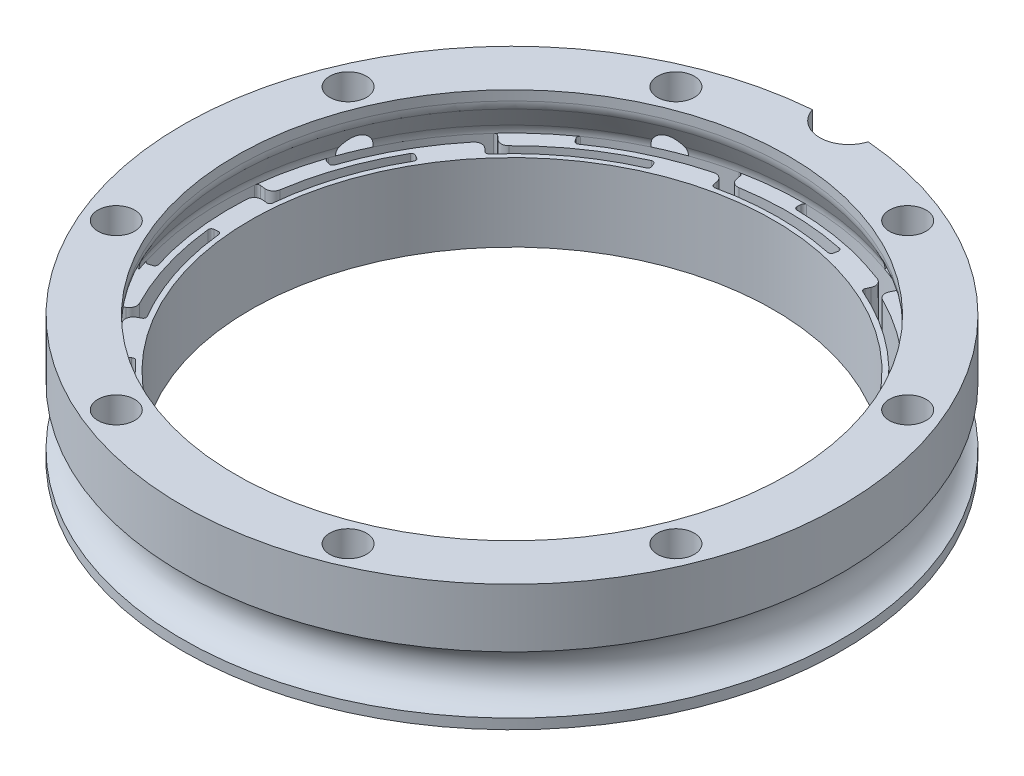
from build123d import *

# Parameters (mm, degrees)
SKETCH1_R                                 = 34
SKETCH1_R_2                               = 27
BOSS_EXTRUDE1_DEPTH                       = 4
CUT_EXTRUDE2_DEPTH                        = 49.744230428
FILLET1_R                                 = 0.3
FILLET2_R                                 = 0.8
CIRPATTERN1_COUNT                         = 10
FILLET1_OF_CIRPATTERN1_R                  = 0.3
FILLET2_OF_CIRPATTERN1_R                  = 0.8
SKETCH6_R                                 = 3.05
SKETCH7_R                                 = 3
CUT_EXTRUDE3_DEPTH                        = 5
CUT_EXTRUDE3_DIRECTION_2_REACH            = 50.744
CUT_EXTRUDE3_DIRECTION_2_END_MAJOR_RADIUS = 34.75
CUT_EXTRUDE3_DIRECTION_2_END_MINOR_RADIUS = 3.05
CUT_EXTRUDE4_REACH                        = 51.81
SKETCH11_R                                = 1.9


with BuildPart() as part:
    # Sketch1 → Boss-Extrude1 (new, symmetric)
    with BuildSketch(Plane(origin=(0, 0, 0), x_dir=(1, 0, 0), z_dir=(0, 1, 0))):
        with Locations(Location((0, 0, 0), (0, 0, 270))):
            Circle(SKETCH1_R)
        with Locations(Location((0, 0, 0), (0, 0, 270))):
            Circle(SKETCH1_R_2, mode=Mode.SUBTRACT)
    extrude(amount=BOSS_EXTRUDE1_DEPTH, both=True)

    # Sketch3 → Cut-Extrude2 (cut, through all)
    with BuildSketch(Plane(origin=(0, 4, 0), x_dir=(1, 0, 0), z_dir=(0, 1, 0))):
        with BuildLine():
            Line((12.720809678, 27.27986439), (12.04462046, 25.829771931))
            ThreePointArc((12.04462046, 25.829771931), (17.055348094, 22.833420711), (21.350359788, 18.878880712))
            Line((21.350359788, 18.878880712), (20.601224357, 18.216463844))
            ThreePointArc((20.601224357, 18.216463844), (16.053540973, 22.327870974), (10.708007901, 25.329598631))
            Line((10.708007901, 25.329598631), (11.384620002, 26.780597966))
            ThreePointArc((11.384620002, 26.780597966), (5.809242601, 28.514254337), (0, 29.1))
            Line((0, 29.1), (0, 30.1))
            ThreePointArc((0, 30.1), (6.51483238, 29.386509814), (12.720809678, 27.27986439))
        make_face()
    cut_extrude2 = extrude(amount=-CUT_EXTRUDE2_DEPTH, mode=Mode.SUBTRACT)

    # Fillet1
    fillet1_edges = [part.edges().sort_by_distance(p)[0] for p in [
        (0, 0, -30.1),
        (12.720809678, 0, -27.27986439),
        (21.350359788, 0, -18.878880712),
        (20.601224357, 0, -18.216463844),
        (10.708007901, 0, -25.329598631),
        (0, 0, -29.1),
    ]]
    fillet(fillet1_edges, radius=FILLET1_R)

    # Fillet2
    fillet2_edges = [part.edges().sort_by_distance(p)[0] for p in [
        (12.04462046, 0, -25.829771931),
        (11.384620002, 0, -26.780597966),
    ]]
    fillet(fillet2_edges, radius=FILLET2_R)

    # CirPattern1: Cut-Extrude2 ×10 about axis
    cirpattern1_axis = Axis((0, 0, 0), (0, 1, 0))
    for i in range(1, CIRPATTERN1_COUNT):
        add(cut_extrude2.rotate(cirpattern1_axis, i * 360 / CIRPATTERN1_COUNT), mode=Mode.SUBTRACT)

    # Fillet1 of CirPattern1
    fillet1_of_cirpattern1_edges = [part.edges().sort_by_distance(p)[0] for p in [
        (-17.692336094, 0, -24.351411531),
        (-5.743350761, 0, -29.546978222),
        (6.176076243, 0, -27.822761945),
        (5.959371813, 0, -26.846524684),
        (-6.225404154, 0, -26.786084878),
        (-17.104550842, 0, -23.542394536),
        (-28.62680114, 0, -9.301411531),
        (-22.013746419, 0, -20.528150638),
        (-11.357258511, 0, -26.139293776),
        (-10.958758212, 0, -25.222125574),
        (-20.780923416, 0, -18.011197128),
        (-27.675744624, 0, -8.992394536),
        (-28.62680114, 0, 9.301411531),
        (-29.875639164, 0, -3.668267236),
        (-24.552506532, 0, -14.471503827),
        (-23.691015074, 0, -13.963731763),
        (-27.39883625, 0, -2.356644253),
        (-27.675744624, 0, 8.992394536),
        (-17.692336094, 0, 24.351411531),
        (-26.326053185, 0, 14.592769569),
        (-28.369531567, 0, 2.723908716),
        (-27.374109406, 0, 2.628332971),
        (-23.551324889, 0, 14.198066628),
        (-17.104550842, 0, 23.542394536),
        (0, 0, 30.1),
        (-12.720809678, 0, 27.27986439),
        (-21.350359788, 0, 18.878880712),
        (-20.601224357, 0, 18.216463844),
        (-10.708007901, 0, 25.329598631),
        (0, 0, 29.1),
        (17.692336094, 0, 24.351411531),
        (5.743350761, 0, 29.546978222),
        (-6.176076243, 0, 27.822761945),
        (-5.959371813, 0, 26.846524684),
        (6.225404154, 0, 26.786084878),
        (17.104550842, 0, 23.542394536),
        (28.62680114, 0, 9.301411531),
        (22.013746419, 0, 20.528150638),
        (11.357258511, 0, 26.139293776),
        (10.958758212, 0, 25.222125574),
        (20.780923416, 0, 18.011197128),
        (27.675744624, 0, 8.992394536),
        (28.62680114, 0, -9.301411531),
        (29.875639164, 0, 3.668267236),
        (24.552506532, 0, 14.471503827),
        (23.691015074, 0, 13.963731763),
        (27.39883625, 0, 2.356644253),
        (27.675744624, 0, -8.992394536),
        (17.692336094, 0, -24.351411531),
        (26.326053185, 0, -14.592769569),
        (28.369531567, 0, -2.723908716),
        (27.374109406, 0, -2.628332971),
        (23.551324889, 0, -14.198066628),
        (17.104550842, 0, -23.542394536),
    ]]
    fillet(fillet1_of_cirpattern1_edges, radius=FILLET1_OF_CIRPATTERN1_R)

    # Fillet2 of CirPattern1
    fillet2_of_cirpattern1_edges = [part.edges().sort_by_distance(p)[0] for p in [
        (-5.438056368, 0, -27.976374728),
        (-6.530889475, 0, -28.357670614),
        (-20.843580496, 0, -19.436953262),
        (-21.95182115, 0, -19.10307693),
        (-28.287565322, 0, -3.473276287),
        (-28.987903261, 0, -2.551757148),
        (-24.926661653, 0, 13.817074177),
        (-24.951591588, 0, 14.974247133),
        (-12.04462046, 0, 25.829771931),
        (-11.384620002, 0, 26.780597966),
        (5.438056368, 0, 27.976374728),
        (6.530889475, 0, 28.357670614),
        (20.843580496, 0, 19.436953262),
        (21.95182115, 0, 19.10307693),
        (28.287565322, 0, 3.473276287),
        (28.987903261, 0, 2.551757148),
        (24.926661653, 0, -13.817074177),
        (24.951591588, 0, -14.974247133),
    ]]
    fillet(fillet2_of_cirpattern1_edges, radius=FILLET2_OF_CIRPATTERN1_R)

    # Sketch6 → Cut-Revolve1 (revolve, cut)
    with BuildSketch(Plane.XY):
        with Locations((-34.75, 0)):
            Circle(SKETCH6_R)
    revolve(axis=Axis((0, 0, 0), (0, -1, 0)), mode=Mode.SUBTRACT)

    # Sketch10 → Revolve2 (revolve)
    with BuildSketch(Plane.XY, mode=Mode.PRIVATE) as revolve2_sk:
        with BuildLine():
            Line((-34, 9), (-34, 4))
            Line((-34, 4), (-30.1, 4))
            ThreePointArc((-30.1, 4), (-30.046250959, 4.446648677), (-29.888072829, 4.867794352))
            Line((-29.888072829, 4.867794352), (-28.711927171, 7.132205648))
            ThreePointArc((-28.711927171, 7.132205648), (-28.553749041, 7.553351323), (-28.5, 8))
            Line((-28.5, 8), (-28.5, 9))
            Line((-28.5, 9), (-34, 9))
        make_face()
    revolve(revolve2_sk.sketch.rotate(Axis((0, 0, 0), (0, 1, 0)), 270), axis=Axis((0, 0, 0), (0, 1, 0)))

    # Sketch7 → Cut-Extrude3 (cut)
    with BuildSketch(Plane(origin=(0, 4, 0), x_dir=(1, 0, 0), z_dir=(0, 1, 0))):
        with Locations((0, 34.75)):
            Circle(SKETCH7_R)
    extrude(amount=CUT_EXTRUDE3_DEPTH, mode=Mode.SUBTRACT)

    # Cut-Extrude3 direction 2: up to this torus (the profile starts outside it)
    cut_extrude3_direction_2_end = Plane(origin=(0, 0, 0), z_dir=(0, 1, 0)) * Torus(CUT_EXTRUDE3_DIRECTION_2_END_MAJOR_RADIUS, CUT_EXTRUDE3_DIRECTION_2_END_MINOR_RADIUS, mode=Mode.PRIVATE)
    # Sketch7 → Cut-Extrude3 direction 2 (cut, up to the surface)
    with BuildSketch(Plane(origin=(0, 4, 0), x_dir=(1, 0, 0), z_dir=(0, 1, 0)), mode=Mode.PRIVATE) as cut_extrude3_direction_2_sk1:
        with Locations((0, 34.75)):
            Circle(SKETCH7_R)
    cut_extrude3_direction_2_tool1 = extrude(cut_extrude3_direction_2_sk1.sketch, amount=-CUT_EXTRUDE3_DIRECTION_2_REACH, mode=Mode.PRIVATE) - cut_extrude3_direction_2_end
    add(cut_extrude3_direction_2_tool1.solids().sort_by_distance((0, 4, -34.75))[0], mode=Mode.SUBTRACT)

    # Cut-Extrude4: up to this face of the body (flat: up to its plane)
    cut_extrude4_end = Plane(part.part.faces().sort_by_distance((-10.259326624, 4, 26.339190316))[0])
    # Sketch11 → Cut-Extrude4 (cut, up to the picked face)
    with BuildSketch(Plane(origin=(0, 9, 0), x_dir=(1, 0, 0), z_dir=(0, 1, 0)), mode=Mode.PRIVATE) as cut_extrude4_sk1:
        with Locations(Location((11.958857261, 28.871235391, 0), (0, 0, 270))):
            Circle(SKETCH11_R)
    cut_extrude4_tool1 = split(extrude(cut_extrude4_sk1.sketch, amount=-CUT_EXTRUDE4_REACH, mode=Mode.PRIVATE), bisect_by=cut_extrude4_end, keep=Keep.BOTH, mode=Mode.PRIVATE)
    # Sketch11 → Cut-Extrude4 (cut, up to the picked face)
    with BuildSketch(Plane(origin=(0, 9, 0), x_dir=(1, 0, 0), z_dir=(0, 1, 0)), mode=Mode.PRIVATE) as cut_extrude4_sk2:
        with Locations(Location((28.871235391, 11.958857261, 0), (0, 0, 270))):
            Circle(SKETCH11_R)
    cut_extrude4_tool2 = split(extrude(cut_extrude4_sk2.sketch, amount=-CUT_EXTRUDE4_REACH, mode=Mode.PRIVATE), bisect_by=cut_extrude4_end, keep=Keep.BOTH, mode=Mode.PRIVATE)
    # Sketch11 → Cut-Extrude4 (cut, up to the picked face)
    with BuildSketch(Plane(origin=(0, 9, 0), x_dir=(1, 0, 0), z_dir=(0, 1, 0)), mode=Mode.PRIVATE) as cut_extrude4_sk3:
        with Locations(Location((28.871235391, -11.958857261, 0), (0, 0, 270))):
            Circle(SKETCH11_R)
    cut_extrude4_tool3 = split(extrude(cut_extrude4_sk3.sketch, amount=-CUT_EXTRUDE4_REACH, mode=Mode.PRIVATE), bisect_by=cut_extrude4_end, keep=Keep.BOTH, mode=Mode.PRIVATE)
    # Sketch11 → Cut-Extrude4 (cut, up to the picked face)
    with BuildSketch(Plane(origin=(0, 9, 0), x_dir=(1, 0, 0), z_dir=(0, 1, 0)), mode=Mode.PRIVATE) as cut_extrude4_sk4:
        with Locations(Location((11.958857261, -28.871235391, 0), (0, 0, 270))):
            Circle(SKETCH11_R)
    cut_extrude4_tool4 = split(extrude(cut_extrude4_sk4.sketch, amount=-CUT_EXTRUDE4_REACH, mode=Mode.PRIVATE), bisect_by=cut_extrude4_end, keep=Keep.BOTH, mode=Mode.PRIVATE)
    # Sketch11 → Cut-Extrude4 (cut, up to the picked face)
    with BuildSketch(Plane(origin=(0, 9, 0), x_dir=(1, 0, 0), z_dir=(0, 1, 0)), mode=Mode.PRIVATE) as cut_extrude4_sk5:
        with Locations(Location((-11.958857261, -28.871235391, 0), (0, 0, 270))):
            Circle(SKETCH11_R)
    cut_extrude4_tool5 = split(extrude(cut_extrude4_sk5.sketch, amount=-CUT_EXTRUDE4_REACH, mode=Mode.PRIVATE), bisect_by=cut_extrude4_end, keep=Keep.BOTH, mode=Mode.PRIVATE)
    # Sketch11 → Cut-Extrude4 (cut, up to the picked face)
    with BuildSketch(Plane(origin=(0, 9, 0), x_dir=(1, 0, 0), z_dir=(0, 1, 0)), mode=Mode.PRIVATE) as cut_extrude4_sk6:
        with Locations(Location((-28.871235391, -11.958857261, 0), (0, 0, 270))):
            Circle(SKETCH11_R)
    cut_extrude4_tool6 = split(extrude(cut_extrude4_sk6.sketch, amount=-CUT_EXTRUDE4_REACH, mode=Mode.PRIVATE), bisect_by=cut_extrude4_end, keep=Keep.BOTH, mode=Mode.PRIVATE)
    # Sketch11 → Cut-Extrude4 (cut, up to the picked face)
    with BuildSketch(Plane(origin=(0, 9, 0), x_dir=(1, 0, 0), z_dir=(0, 1, 0)), mode=Mode.PRIVATE) as cut_extrude4_sk7:
        with Locations(Location((-28.871235391, 11.958857261, 0), (0, 0, 270))):
            Circle(SKETCH11_R)
    cut_extrude4_tool7 = split(extrude(cut_extrude4_sk7.sketch, amount=-CUT_EXTRUDE4_REACH, mode=Mode.PRIVATE), bisect_by=cut_extrude4_end, keep=Keep.BOTH, mode=Mode.PRIVATE)
    # Sketch11 → Cut-Extrude4 (cut, up to the picked face)
    with BuildSketch(Plane(origin=(0, 9, 0), x_dir=(1, 0, 0), z_dir=(0, 1, 0)), mode=Mode.PRIVATE) as cut_extrude4_sk8:
        with Locations(Location((-11.958857261, 28.871235391, 0), (0, 0, 270))):
            Circle(SKETCH11_R)
    cut_extrude4_tool8 = split(extrude(cut_extrude4_sk8.sketch, amount=-CUT_EXTRUDE4_REACH, mode=Mode.PRIVATE), bisect_by=cut_extrude4_end, keep=Keep.BOTH, mode=Mode.PRIVATE)
    add(cut_extrude4_tool1.solids().sort_by(Axis((11.958857, 9, -28.871235), (0, -1, 0)))[0], mode=Mode.SUBTRACT)
    add(cut_extrude4_tool2.solids().sort_by(Axis((28.871235, 9, -11.958857), (0, -1, 0)))[0], mode=Mode.SUBTRACT)
    add(cut_extrude4_tool3.solids().sort_by(Axis((28.871235, 9, 11.958857), (0, -1, 0)))[0], mode=Mode.SUBTRACT)
    add(cut_extrude4_tool4.solids().sort_by(Axis((11.958857, 9, 28.871235), (0, -1, 0)))[0], mode=Mode.SUBTRACT)
    add(cut_extrude4_tool5.solids().sort_by(Axis((-11.958857, 9, 28.871235), (0, -1, 0)))[0], mode=Mode.SUBTRACT)
    add(cut_extrude4_tool6.solids().sort_by(Axis((-28.871235, 9, 11.958857), (0, -1, 0)))[0], mode=Mode.SUBTRACT)
    add(cut_extrude4_tool7.solids().sort_by(Axis((-28.871235, 9, -11.958857), (0, -1, 0)))[0], mode=Mode.SUBTRACT)
    add(cut_extrude4_tool8.solids().sort_by(Axis((-11.958857, 9, -28.871235), (0, -1, 0)))[0], mode=Mode.SUBTRACT)


solid = part.part
